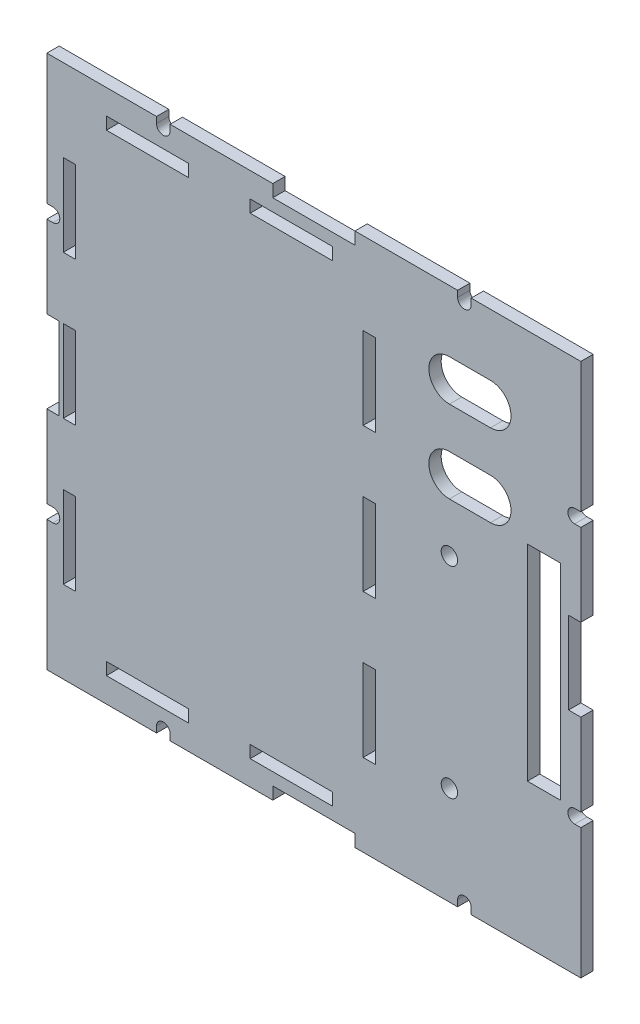
from build123d import *

# Parameters (mm, degrees)
SKETCH1_W           = 20
SKETCH1_H           = 3
SKETCH1_W_2         = 3
SKETCH1_H_2         = 20
SKETCH1_R           = 2
SKETCH1_W_3         = 8
SKETCH1_H_3         = 50
BOSS_EXTRUDE1_DEPTH = 3


with BuildPart() as part:
    # Sketch1 → Boss-Extrude1 (new body)
    with BuildSketch(Plane.XY):
        with BuildLine():
            Line((10, -62), (10, -65))
            Line((10, -65), (35, -65))
            Line((35, -65), (35, -63.5))
            ThreePointArc((35, -63.5), (36.65, -61.85), (38.3, -63.5))
            Line((38.3, -63.5), (38.3, -65))
            Line((38.3, -65), (65, -65))
            Line((65, -65), (65, -33.3))
            Line((65, -33.3), (63.5, -33.3))
            ThreePointArc((63.5, -33.3), (61.85, -31.65), (63.5, -30))
            Line((63.5, -30), (65, -30))
            Line((65, -30), (65, -10))
            Line((65, -10), (62, -10))
            Line((62, -10), (62, 10))
            Line((62, 10), (65, 10))
            Line((65, 10), (65, 30))
            Line((65, 30), (63.5, 30))
            ThreePointArc((63.5, 30), (61.85, 31.65), (63.5, 33.3))
            Line((63.5, 33.3), (65, 33.3))
            Line((65, 33.3), (65, 65))
            Line((65, 65), (38.3, 65))
            Line((38.3, 65), (38.3, 63.5))
            ThreePointArc((38.3, 63.5), (36.65, 61.85), (35, 63.5))
            Line((35, 63.5), (35, 65))
            Line((35, 65), (10, 65))
            Line((10, 65), (10, 62))
            Line((10, 62), (-10, 62))
            Line((-10, 62), (-10, 65))
            Line((-10, 65), (-35, 65))
            Line((-35, 65), (-35, 63.5))
            ThreePointArc((-35, 63.5), (-36.65, 61.85), (-38.3, 63.5))
            Line((-38.3, 63.5), (-38.3, 65))
            Line((-38.3, 65), (-65, 65))
            Line((-65, 65), (-65, 33.3))
            Line((-65, 33.3), (-63.5, 33.3))
            ThreePointArc((-63.5, 33.3), (-61.85, 31.65), (-63.5, 30))
            Line((-63.5, 30), (-65, 30))
            Line((-65, 30), (-65, 10))
            Line((-65, 10), (-62, 10))
            Line((-62, 10), (-62, -10))
            Line((-62, -10), (-65, -10))
            Line((-65, -10), (-65, -30))
            Line((-65, -30), (-63.5, -30))
            ThreePointArc((-63.5, -30), (-61.85, -31.65), (-63.5, -33.3))
            Line((-63.5, -33.3), (-65, -33.3))
            Line((-65, -33.3), (-65, -65))
            Line((-65, -65), (-38.3, -65))
            Line((-38.3, -65), (-38.3, -63.5))
            ThreePointArc((-38.3, -63.5), (-36.65, -61.85), (-35, -63.5))
            Line((-35, -63.5), (-35, -65))
            Line((-35, -65), (-10, -65))
            Line((-10, -65), (-10, -62))
            Line((-10, -62), (10, -62))
        make_face()
        with Locations((-40.5, -57.5)):
            Rectangle(SKETCH1_W, SKETCH1_H, mode=Mode.SUBTRACT)
        with Locations((-59.5, -35)):
            Rectangle(SKETCH1_W_2, SKETCH1_H_2, mode=Mode.SUBTRACT)
        with Locations((-5.5, -57.5)):
            Rectangle(SKETCH1_W, SKETCH1_H, mode=Mode.SUBTRACT)
        with Locations((13.5, -35)):
            Rectangle(SKETCH1_W_2, SKETCH1_H_2, mode=Mode.SUBTRACT)
        with Locations((33, -41)):
            Circle(SKETCH1_R, mode=Mode.SUBTRACT)
        with Locations((56, -5)):
            Rectangle(SKETCH1_W_3, SKETCH1_H_3, mode=Mode.SUBTRACT)
        with Locations((-59.5, 0)):
            Rectangle(SKETCH1_W_2, SKETCH1_H_2, mode=Mode.SUBTRACT)
        with Locations((-59.5, 35)):
            Rectangle(SKETCH1_W_2, SKETCH1_H_2, mode=Mode.SUBTRACT)
        with Locations((-40.5, 57.5)):
            Rectangle(SKETCH1_W, SKETCH1_H, mode=Mode.SUBTRACT)
        with Locations((-5.5, 57.5)):
            Rectangle(SKETCH1_W, SKETCH1_H, mode=Mode.SUBTRACT)
        with Locations((13.5, 0)):
            Rectangle(SKETCH1_W_2, SKETCH1_H_2, mode=Mode.SUBTRACT)
        with Locations((33, 8)):
            Circle(SKETCH1_R, mode=Mode.SUBTRACT)
        with BuildLine():
            ThreePointArc((33, 20), (28, 25), (33, 30))
            Line((33, 30), (43, 30))
            ThreePointArc((43, 30), (48, 25), (43, 20))
            Line((43, 20), (33, 20))
        make_face(mode=Mode.SUBTRACT)
        with Locations((13.5, 35)):
            Rectangle(SKETCH1_W_2, SKETCH1_H_2, mode=Mode.SUBTRACT)
        with BuildLine():
            ThreePointArc((43, 50), (48, 45), (43, 40))
            Line((43, 40), (33, 40))
            ThreePointArc((33, 40), (28, 45), (33, 50))
            Line((33, 50), (43, 50))
        make_face(mode=Mode.SUBTRACT)
    extrude(amount=BOSS_EXTRUDE1_DEPTH)


solid = part.part
